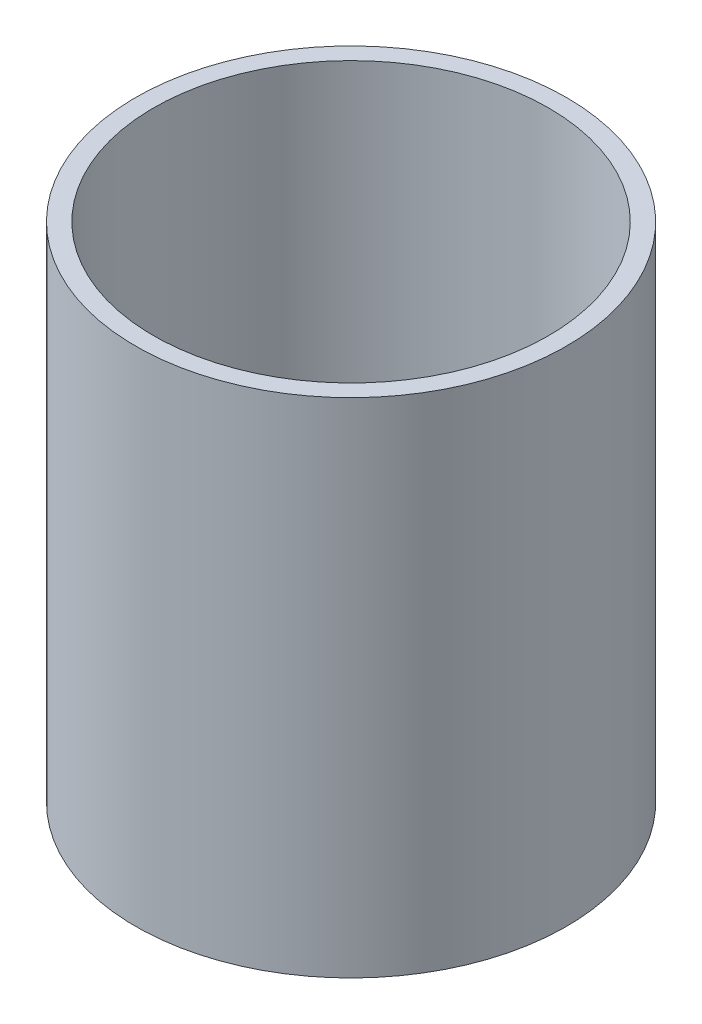
from build123d import *

# Parameters (mm, degrees)
SKETCH1_R           = 18
BOSS_EXTRUDE1_DEPTH = 42
SKETCH4_R           = 16.5
CUT_EXTRUDE2_DEPTH  = 42


with BuildPart() as part:
    # Sketch1 → Boss-Extrude1 (new body)
    with BuildSketch(Plane(origin=(0, 0, 0), x_dir=(1, 0, 0), z_dir=(0, 1, 0))):
        with Locations(Location((0, 0, 0), (0, 0, 90))):
            Circle(SKETCH1_R)
    extrude(amount=BOSS_EXTRUDE1_DEPTH)

    # Sketch4 → Cut-Extrude2 (cut)
    with BuildSketch(Plane.XZ):
        with Locations(Location((0, 0, 0), (0, 0, 270))):
            Circle(SKETCH4_R)
    extrude(amount=-CUT_EXTRUDE2_DEPTH, mode=Mode.SUBTRACT)


solid = part.part
